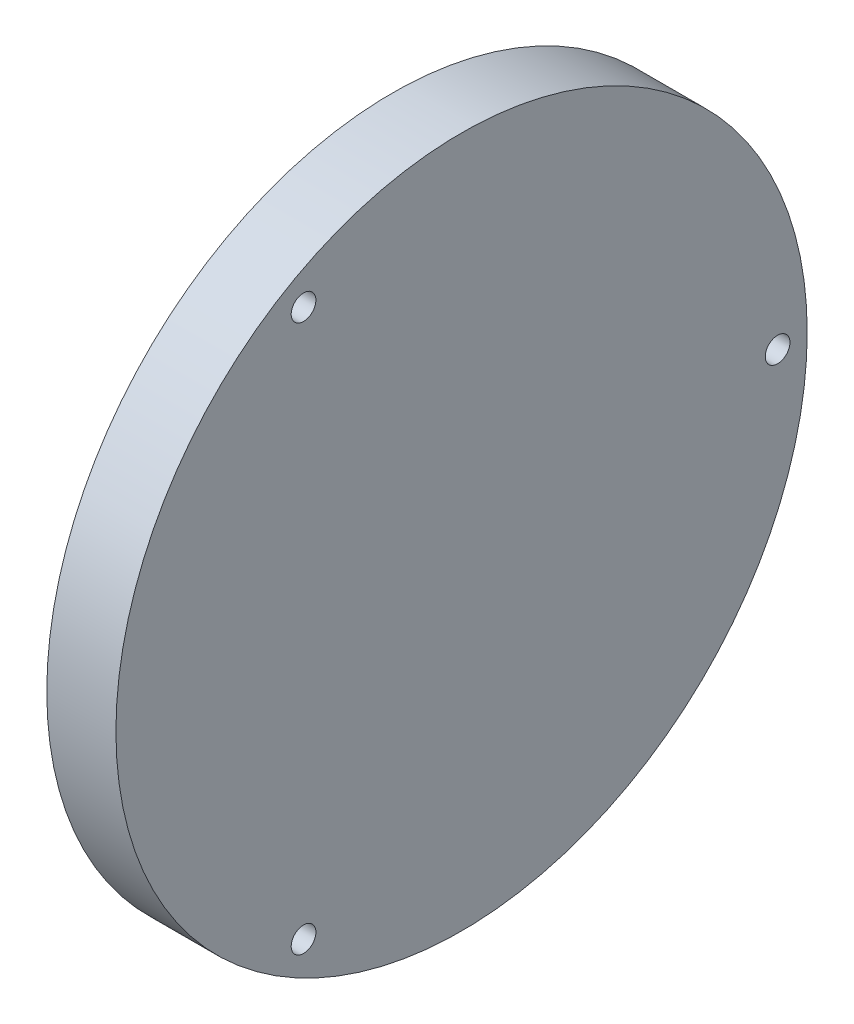
from build123d import *

# Parameters (mm, degrees)
BLANK_OD70_THICKNESS7_MM_W                    = 7
BLANK_OD70_THICKNESS7_MM_H                    = 35
WATER_PASSAGE_R11_25_DEPTH3_ROUND_END_C_DEPTH = 3
INNER_FACE_SEAL_GLAND_WIDTH2P6_DEPTH_2_R      = 9.3
INNER_FACE_SEAL_GLAND_WIDTH2P6_DEPTH_2_R_2    = 6.7
INNER_FACE_SEAL_GLAND_WIDTH2P6_DEPTH1P5_DEPTH = 1.5
OUTER_FACE_SEAL_GLAND_WIDTH2P6_DEPTH_2_R      = 29.3
OUTER_FACE_SEAL_GLAND_WIDTH2P6_DEPTH_2_R_2    = 26.7
OUTER_FACE_SEAL_GLAND_WIDTH2P6_DEPTH1P5_DEPTH = 1.5
SIX_REAR_COVER_M3_PILOT_BORES_DEPTH4_SKE_R    = 1.25
SIX_REAR_COVER_M3_PILOT_BORES_DEPTH4_DEPTH    = 4
THREE_START                                   = 4
THREE_FRONT_CLAMP_M3_PILOT_BORES_DEP_2_R      = 1.25
THREE_FRONT_CLAMP_M3_PILOT_BORES_DEPTH3_DEPTH = 3


with BuildPart() as part:
    # Blank OD70 thickness7 mm → Copper blank - OD70 x7 (revolve)
    with BuildSketch(Plane.XY, mode=Mode.PRIVATE) as copper_blank_od70_x7_sk:
        with Locations((3.5, 17.5)):
            Rectangle(BLANK_OD70_THICKNESS7_MM_W, BLANK_OD70_THICKNESS7_MM_H)
    revolve(copper_blank_od70_x7_sk.sketch.rotate(Axis((-10, 0, 0), (1, 0, 0)), 90), axis=Axis((-10, 0, 0), (1, 0, 0)))

    # Water passage R11-25 depth3 round-en 2 → Water passage R11-25 depth3 round-end C (cut)
    with BuildSketch(Plane(origin=(0, 0, 0), x_dir=(0, 0, -1), z_dir=(1, 0, 0))):
        with BuildLine():
            ThreePointArc((-12.5, 21.650635095), (0, -25), (12.5, 21.650635095))
            ThreePointArc((12.5, 21.650635095), (2.937822174, 19.088457268), (5.5, 9.526279442))
            ThreePointArc((5.5, 9.526279442), (0, -11), (-5.5, 9.526279442))
            ThreePointArc((-5.5, 9.526279442), (-2.937822174, 19.088457268), (-12.5, 21.650635095))
        make_face()
    extrude(amount=WATER_PASSAGE_R11_25_DEPTH3_ROUND_END_C_DEPTH, mode=Mode.SUBTRACT)

    # Inner face-seal gland width2p6 depth 2 → Inner face-seal gland width2p6 depth1p5 (cut)
    with BuildSketch(Plane(origin=(0, 0, 0), x_dir=(0, 0, -1), z_dir=(1, 0, 0))):
        Circle(INNER_FACE_SEAL_GLAND_WIDTH2P6_DEPTH_2_R)
        Circle(INNER_FACE_SEAL_GLAND_WIDTH2P6_DEPTH_2_R_2, mode=Mode.SUBTRACT)
    extrude(amount=INNER_FACE_SEAL_GLAND_WIDTH2P6_DEPTH1P5_DEPTH, mode=Mode.SUBTRACT)

    # Outer face-seal gland width2p6 depth 2 → Outer face-seal gland width2p6 depth1p5 (cut)
    with BuildSketch(Plane(origin=(0, 0, 0), x_dir=(0, 0, -1), z_dir=(1, 0, 0))):
        Circle(OUTER_FACE_SEAL_GLAND_WIDTH2P6_DEPTH_2_R)
        Circle(OUTER_FACE_SEAL_GLAND_WIDTH2P6_DEPTH_2_R_2, mode=Mode.SUBTRACT)
    extrude(amount=OUTER_FACE_SEAL_GLAND_WIDTH2P6_DEPTH1P5_DEPTH, mode=Mode.SUBTRACT)

    # Six rear cover M3 pilot bores depth4 sketch → Six rear cover M3 pilot bores depth4 (cut)
    with BuildSketch(Plane(origin=(0, 0, 0), x_dir=(0, 0, -1), z_dir=(1, 0, 0))):
        with Locations((0, 32)):
            Circle(SIX_REAR_COVER_M3_PILOT_BORES_DEPTH4_SKE_R)
        with Locations((-27.712812921, 16)):
            Circle(SIX_REAR_COVER_M3_PILOT_BORES_DEPTH4_SKE_R)
        with Locations((-27.712812921, -16)):
            Circle(SIX_REAR_COVER_M3_PILOT_BORES_DEPTH4_SKE_R)
        with Locations((0, -32)):
            Circle(SIX_REAR_COVER_M3_PILOT_BORES_DEPTH4_SKE_R)
        with Locations((27.712812921, -16)):
            Circle(SIX_REAR_COVER_M3_PILOT_BORES_DEPTH4_SKE_R)
        with Locations((27.712812921, 16)):
            Circle(SIX_REAR_COVER_M3_PILOT_BORES_DEPTH4_SKE_R)
    extrude(amount=SIX_REAR_COVER_M3_PILOT_BORES_DEPTH4_DEPTH, mode=Mode.SUBTRACT)

    # Three front clamp M3 pilot bores dep 2 → Three front clamp M3 pilot bores depth3 (cut)
    with BuildSketch(Plane(origin=(0, 0, 0), x_dir=(0, 0, -1), z_dir=(1, 0, 0)).offset(THREE_START)):
        with Locations((-16, 27.712812921)):
            Circle(THREE_FRONT_CLAMP_M3_PILOT_BORES_DEP_2_R)
        with Locations((-16, -27.712812921)):
            Circle(THREE_FRONT_CLAMP_M3_PILOT_BORES_DEP_2_R)
        with Locations((32, 0)):
            Circle(THREE_FRONT_CLAMP_M3_PILOT_BORES_DEP_2_R)
    extrude(amount=THREE_FRONT_CLAMP_M3_PILOT_BORES_DEPTH3_DEPTH, mode=Mode.SUBTRACT)


solid = part.part
